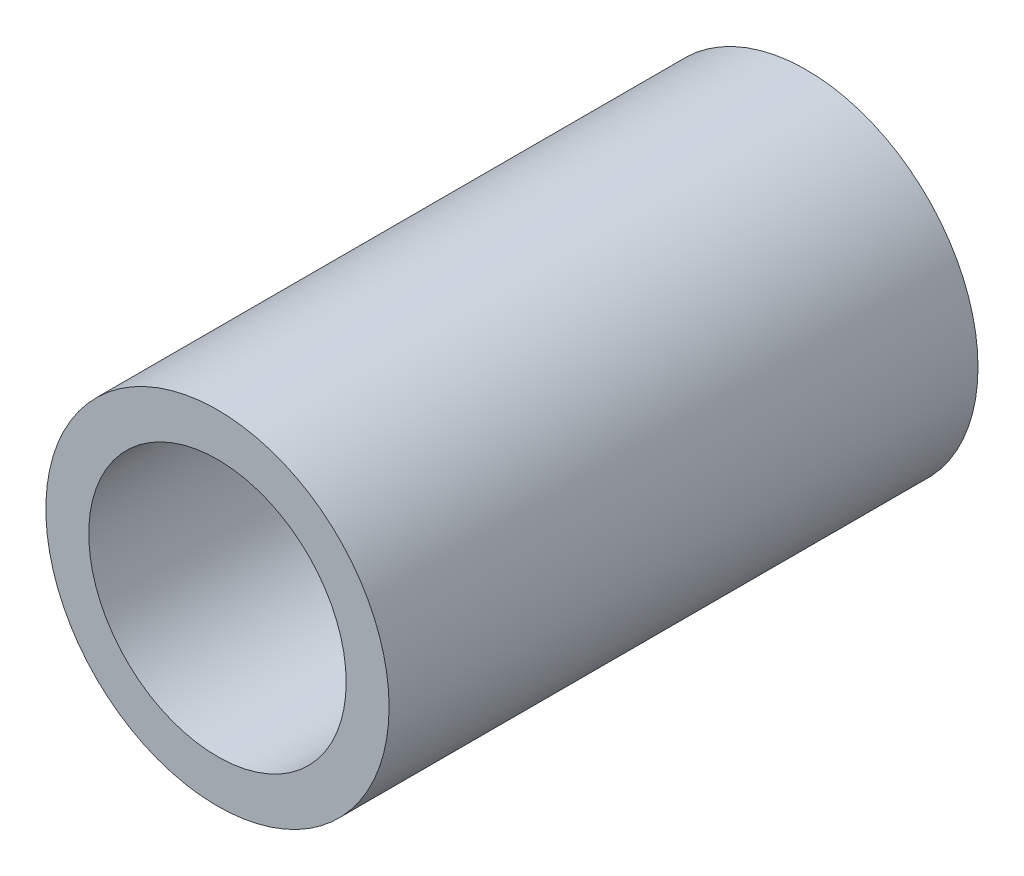
from build123d import *

# Parameters (mm, degrees)
SKETCH1_R          = 12.7
BASE_EXTRUDE_DEPTH = 28.575
SKETCH2_R          = 9.525
CUT_EXTRUDE1_DEPTH = 34.750712955
SKETCH_1_R         = 12.7
SKETCH_1_R_2       = 9.525
EXTRUDE_1_DEPTH    = 43.58


with BuildPart() as part:
    # Sketch1 → Base-Extrude (new body)
    with BuildSketch(Plane.XY):
        Circle(SKETCH1_R)
    extrude(amount=BASE_EXTRUDE_DEPTH)

    # Sketch2 → Cut-Extrude1 (cut, through all)
    with BuildSketch(Plane.XY.offset(28.575)):
        Circle(SKETCH2_R)
    extrude(amount=-CUT_EXTRUDE1_DEPTH, mode=Mode.SUBTRACT)

    # Эскиз1 → Бобышка-Вытянуть1 (add)
    with BuildSketch(Plane.XY.offset(28.575)):
        Circle(SKETCH_1_R)
        Circle(SKETCH_1_R_2, mode=Mode.SUBTRACT)
    extrude(amount=-EXTRUDE_1_DEPTH)


solid = part.part
